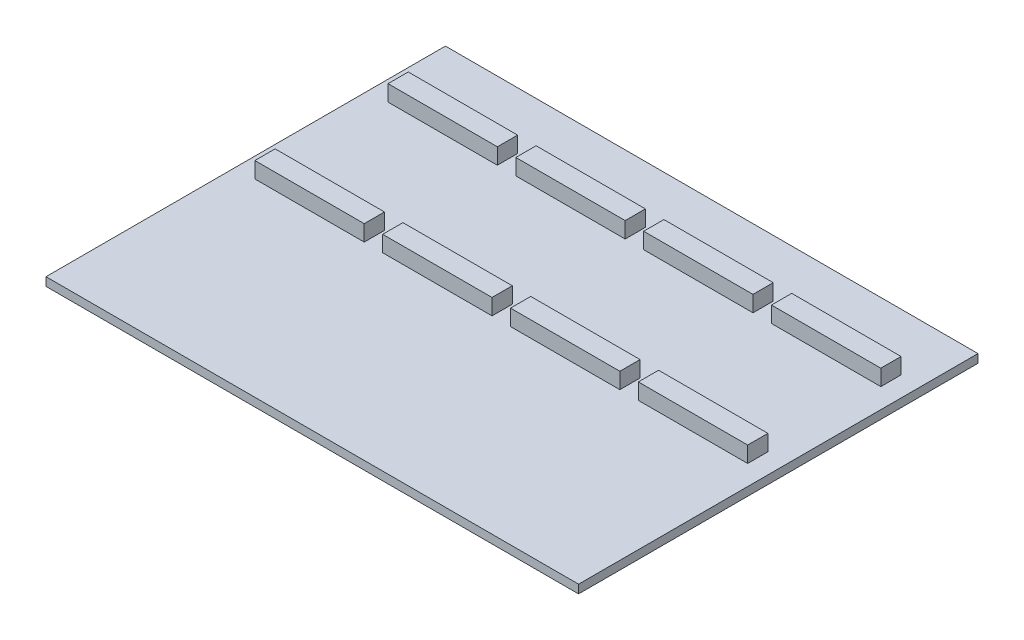
from build123d import *

# Parameters (mm, degrees)
SKETCH1_W            = 100
SKETCH1_H            = 75
BOSS_EXTRUDE1_DEPTH  = 1.5875
SKETCH2_W            = 20.53
SKETCH2_H            = 3.8
BOSS_EXTRUDE2_DEPTH  = 4.5875
LPATTERN1_COUNT      = 4
LPATTERN1_PITCH      = 24
LPATTERN1_COUNT_DIR2 = 2
LPATTERN1_PITCH_DIR2 = 25


with BuildPart() as part:
    # Sketch1 → Boss-Extrude1 (new body)
    with BuildSketch(Plane(origin=(0, 0, 0), x_dir=(1, 0, 0), z_dir=(0, 1, 0))):
        with Locations((50, 37.5)):
            Rectangle(SKETCH1_W, SKETCH1_H)
    extrude(amount=BOSS_EXTRUDE1_DEPTH)

    # Sketch2 → Boss-Extrude2 (add)
    with BuildSketch(Plane(origin=(0, 0, 0), x_dir=(1, 0, 0), z_dir=(0, 1, 0))):
        with Locations((13.985, 37.4)):
            Rectangle(SKETCH2_W, SKETCH2_H)
    boss_extrude2 = extrude(amount=BOSS_EXTRUDE2_DEPTH)

    # LPattern1: Boss-Extrude2 4 × 2
    with Locations(*[(i * LPATTERN1_PITCH, 0, -j * LPATTERN1_PITCH_DIR2) for i in range(LPATTERN1_COUNT) for j in range(LPATTERN1_COUNT_DIR2) if (i, j) != (0, 0)]):
        add(boss_extrude2)


solid = part.part
